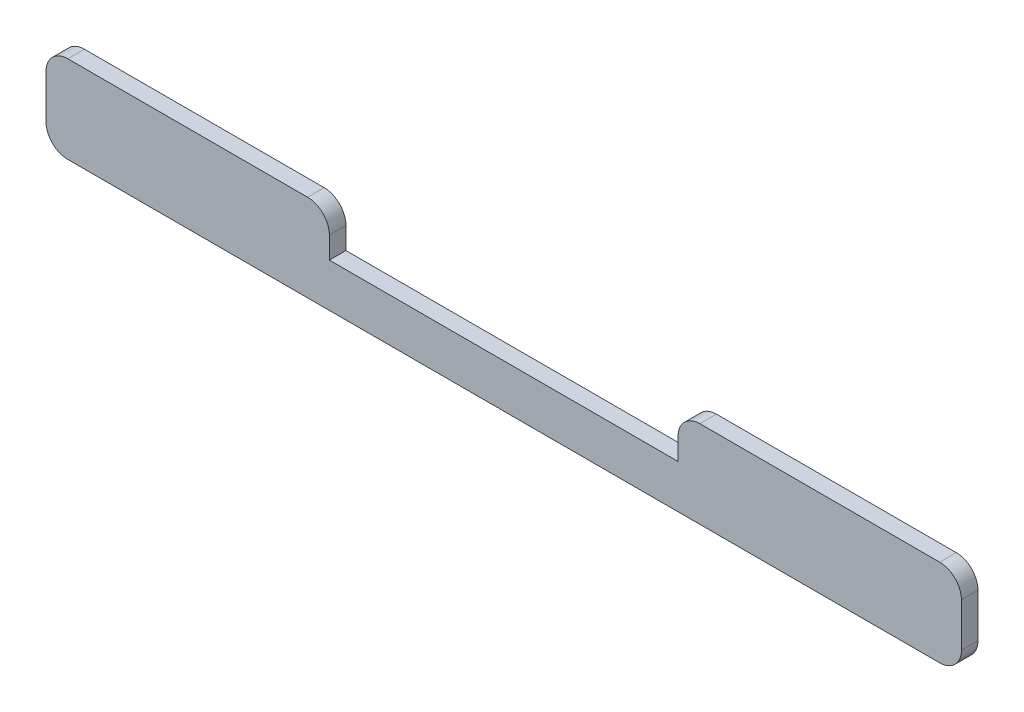
from build123d import *

# Parameters (mm, degrees)
BOSS_EXTRUDE1_DEPTH = 4.826


with BuildPart() as part:
    # Sketch1 → Boss-Extrude1 (new body)
    with BuildSketch(Plane.XY):
        with BuildLine():
            ThreePointArc((76.2, 25.4), (80.690128061, 23.540128061), (82.55, 19.05))
            Line((82.55, 19.05), (82.55, 12.7))
            Line((82.55, 12.7), (184.15, 12.7))
            Line((184.15, 12.7), (184.15, 19.05))
            ThreePointArc((184.15, 19.05), (186.009871939, 23.540128061), (190.5, 25.4))
            Line((190.5, 25.4), (260.35, 25.4))
            ThreePointArc((260.35, 25.4), (264.840128061, 23.540128061), (266.7, 19.05))
            Line((266.7, 19.05), (266.7, 6.35))
            ThreePointArc((266.7, 6.35), (264.840128061, 1.859871939), (260.35, 0))
            Line((260.35, 0), (6.35, 0))
            ThreePointArc((6.35, 0), (1.859871939, 1.859871939), (0, 6.35))
            Line((0, 6.35), (0, 19.05))
            ThreePointArc((0, 19.05), (1.859871939, 23.540128061), (6.35, 25.4))
            Line((6.35, 25.4), (76.2, 25.4))
        make_face()
    extrude(amount=BOSS_EXTRUDE1_DEPTH)


solid = part.part
